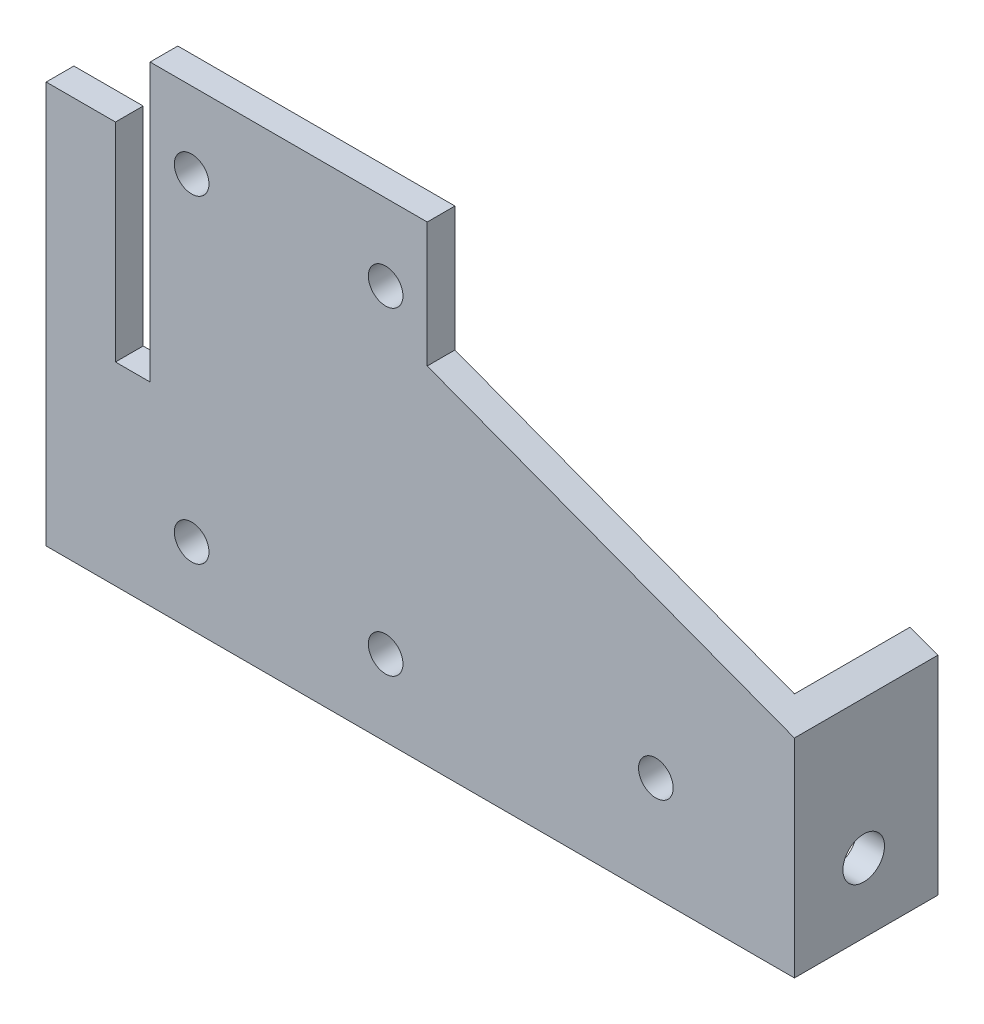
from build123d import *

# Parameters (mm, degrees)
SKETCH_1_R          = 2.5
EXTRUDE_1_DEPTH     = 4
EXTRUDE_2_DEPTH     = 20.7
SKETCH_3_R          = 3
CUT_EXTRUDE_1_DEPTH = 6.7
CUT_EXTRUDE_2_DEPTH = 10


with BuildPart() as part:
    # Эскиз1 → Бобышка-Вытянуть1 (new body)
    with BuildSketch(Plane.XY):
        Polygon((0, 0), (108, 0), (108, 30), (55, 50), (55, 68), (0, 68), align=None)
        with Locations((21, 57)):
            Circle(SKETCH_1_R, mode=Mode.SUBTRACT)
        with Locations((49, 57)):
            Circle(SKETCH_1_R, mode=Mode.SUBTRACT)
        with Locations((21, 11)):
            Circle(SKETCH_1_R, mode=Mode.SUBTRACT)
        with Locations((49, 11)):
            Circle(SKETCH_1_R, mode=Mode.SUBTRACT)
        with Locations((88, 15)):
            Circle(SKETCH_1_R, mode=Mode.SUBTRACT)
    extrude(amount=EXTRUDE_1_DEPTH)

    # Эскиз2 → Бобышка-Вытянуть2 (add)
    with BuildSketch(Plane.XY.offset(4)):
        Polygon((108, 0), (104, 0), (104, 31.509433962), (108, 30), align=None)
    extrude(amount=-EXTRUDE_2_DEPTH)

    # Эскиз3 → Вырез-Вытянуть1 (cut)
    with BuildSketch(Plane(origin=(108, 0, 0), x_dir=(0, 0, -1), z_dir=(1, 0, 0))):
        with Locations((6, 10)):
            Circle(SKETCH_3_R)
    extrude(amount=-CUT_EXTRUDE_1_DEPTH, mode=Mode.SUBTRACT)

    # Эскиз4 → Вырез-Вытянуть2 (cut)
    with BuildSketch(Plane(origin=(0, 0, 0), x_dir=(-1, 0, 0), z_dir=(0, 0, -1))):
        Polygon((0, 68), (-15, 68), (-15, 48), (-15, 28), (-10, 28), (-10, 58), (0, 58), align=None)
    extrude(amount=-CUT_EXTRUDE_2_DEPTH, mode=Mode.SUBTRACT)


solid = part.part
